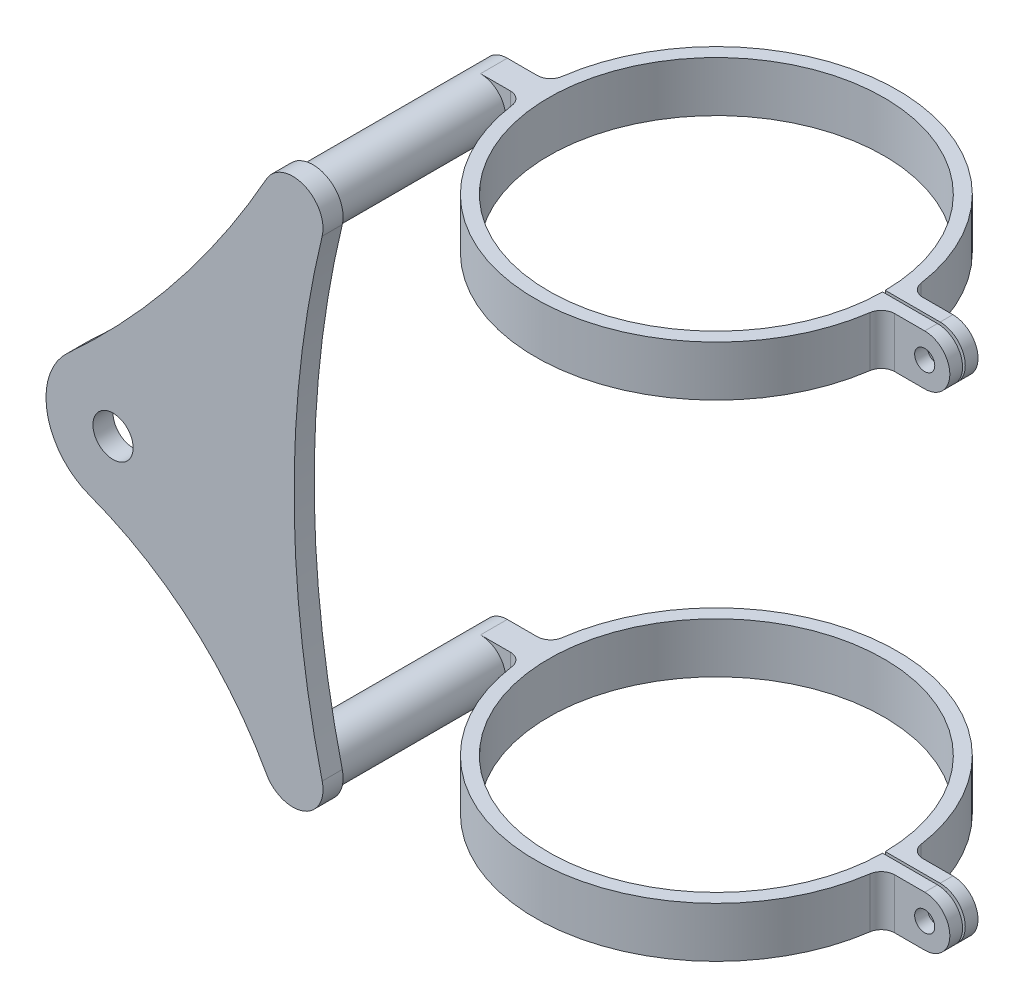
from build123d import *

# Parameters (mm, degrees)
BOSS_EXTRUDE1_DEPTH     = 3.75
CUT_EXTRUDE1_DEPTH      = 48.166697998
CUT_EXTRUDE1_DEPTH_BACK = 48.166697998
SKETCH2_R               = 1.5
BOSS_EXTRUDE2_START     = -4
SKETCH3_R               = 3.75
BOSS_EXTRUDE2_DEPTH     = 29
SKETCH4_R               = 3
SKETCH4_R_2             = 3.75
BOSS_EXTRUDE3_DEPTH     = 3
CUT_EXTRUDE2_DEPTH      = 1


with BuildPart() as part:
    # Sketch1 → Boss-Extrude1 (new, symmetric)
    with BuildSketch(Plane(origin=(0, 0, 0), x_dir=(-1, 0, 0), z_dir=(0, 1, 0))):
        with BuildLine():
            Line((-36.93, 2.1), (-28.70870948, 2.1))
            ThreePointArc((-28.70870948, 2.1), (-27.398273911, 2.589119918), (-26.728798481, 3.817241379))
            ThreePointArc((-26.728798481, 3.817241379), (0.047012438, 26.999959071), (26.741929561, 3.724137931))
            ThreePointArc((26.741929561, 3.724137931), (27.409748904, 2.491403941), (28.722813233, 2))
            Line((28.722813233, 2), (33.18, 2))
            Line((33.18, 2), (33.18, -2))
            Line((33.18, -2), (28.722813233, -2))
            ThreePointArc((28.722813233, -2), (27.409748904, -2.491403941), (26.741929561, -3.724137931))
            ThreePointArc((26.741929561, -3.724137931), (0.047012438, -26.999959071), (-26.728798481, -3.817241379))
            ThreePointArc((-26.728798481, -3.817241379), (-27.398273911, -2.589119918), (-28.70870948, -2.1))
            Line((-28.70870948, -2.1), (-36.93, -2.1))
            Line((-36.93, -2.1), (-36.93, -0.2))
            Line((-36.93, -0.2), (-24.999199987, -0.2))
            ThreePointArc((-24.999199987, -0.2), (25, 0), (-24.999199987, 0.2))
            Line((-24.999199987, 0.2), (-36.93, 0.2))
            Line((-36.93, 0.2), (-36.93, 2.1))
        make_face()
    extrude(amount=BOSS_EXTRUDE1_DEPTH, both=True)

    # Sketch2 → Cut-Extrude1 (cut, two sides: drawn at the far end of the back side and taken through both)
    with BuildSketch(Plane.XY.offset(2.1).offset(-CUT_EXTRUDE1_DEPTH_BACK)):
        with BuildLine():
            Line((36.93, 0), (36.93, 3.75))
            Line((36.93, 3.75), (33.18, 3.75))
            ThreePointArc((33.18, 3.75), (35.831650429, 2.651650429), (36.93, 0))
        make_face()
        with BuildLine():
            Line((36.93, -3.75), (36.93, 0))
            ThreePointArc((36.93, 0), (35.831650429, -2.651650429), (33.18, -3.75))
            Line((33.18, -3.75), (36.93, -3.75))
        make_face()
        with Locations((33.18, 0)):
            Circle(SKETCH2_R)
    extrude(amount=CUT_EXTRUDE1_DEPTH + CUT_EXTRUDE1_DEPTH_BACK, mode=Mode.SUBTRACT)

    # Sketch3 → Boss-Extrude2 (add)
    with BuildSketch(Plane.XY.offset(2).offset(BOSS_EXTRUDE2_START)):
        with Locations(Location((-33.17, 0, 0), (0, 0, 180))):
            Circle(SKETCH3_R)
    extrude(amount=BOSS_EXTRUDE2_DEPTH)


with BuildPart() as body_2:
    # Body-Move/Copy1: copy of part
    add(part.part.moved(Location((0, -72.5, 0))))


with BuildPart() as part_1:
    add(part.part)

    add(body_2.part)  # Boss-Extrude3 merges body 2
    # Sketch4 → Boss-Extrude3 (add)
    # profile 1 of 2: a face of its own
    with BuildSketch(Plane.XY.offset(27)):
        with BuildLine():
            ThreePointArc((-63.482977809, -51.870117717), (-48.248375933, -60.895538839), (-37.114961483, -74.665012447))
            ThreePointArc((-37.114961483, -74.665012447), (-31.545330888, -76.696480701), (-28.795616265, -71.444174757))
            ThreePointArc((-28.795616265, -71.444174757), (-32.982825115, -36.25), (-28.795616265, -1.055825243))
            ThreePointArc((-28.795616265, -1.055825243), (-31.524893516, 4.188511031), (-37.09366658, 2.203370275))
            ThreePointArc((-37.09366658, 2.203370275), (-50.421900488, -17.640799048), (-66.733284536, -35.115684618))
            ThreePointArc((-66.733284536, -35.115684618), (-69.806976307, -44.404462177), (-63.482977809, -51.870117717))
        make_face()
        with Locations((-59.99, -42.5)):
            Circle(SKETCH4_R, mode=Mode.SUBTRACT)
        with Locations(Location((-33.17, -72.5, 0), (0, 0, 180))):
            Circle(SKETCH4_R_2, mode=Mode.SUBTRACT)
    # profile 2 of 2: a face of its own
    with BuildSketch(Plane.XY.offset(27)):
        with Locations(Location((-33.17, -72.5, 0), (0, 0, 180))):
            Circle(SKETCH4_R_2)
    extrude(amount=BOSS_EXTRUDE3_DEPTH)

    # Sketch5 → Cut-Extrude2 (cut)
    with BuildSketch(Plane(origin=(0, 0, 27), x_dir=(1, 0, 0), z_dir=(0, 0, -1))):
        with BuildLine():
            Line((-38.884156213, 63.752554506), (-36.884156213, 63.752554506))
            ThreePointArc((-36.884156213, 63.752554506), (-35.358719938, 63.046016594), (-34.911062224, 61.425598679))
            ThreePointArc((-34.911062224, 61.425598679), (-36.978469514, 35.091765908), (-34.515193771, 8.792009371))
            ThreePointArc((-34.515193771, 8.792009371), (-35.751988173, 6.573851631), (-38.16775438, 7.357406215))
            ThreePointArc((-38.16775438, 7.357406215), (-48.567697695, 21.716067782), (-60.549030633, 34.784259851))
            ThreePointArc((-60.549030633, 34.784259851), (-60.782300133, 35.868309862), (-59.871765467, 36.501165064))
            ThreePointArc((-59.871765467, 36.501165064), (-54.085301002, 41.434856938), (-57.783175082, 48.079419663))
            ThreePointArc((-57.783175082, 48.079419663), (-58.414835004, 48.976588199), (-57.843234491, 49.913166275))
            ThreePointArc((-57.843234491, 49.913166275), (-48.441923829, 55.600366923), (-40.386431593, 63.072845642))
            ThreePointArc((-40.386431593, 63.072845642), (-39.708600792, 63.574721111), (-38.884156213, 63.752554506))
        make_face()
    extrude(amount=-CUT_EXTRUDE2_DEPTH, mode=Mode.SUBTRACT)


solid = part_1.part
